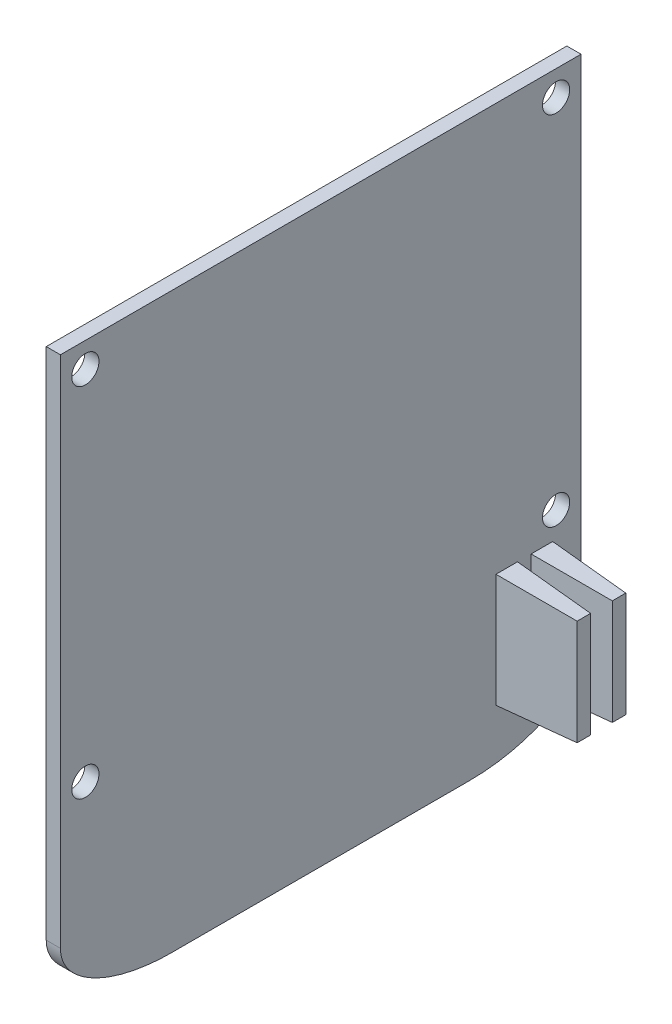
from build123d import *

# Parameters (mm, degrees)
BOSS_EXTRUDE1_DEPTH           = 1.5875
SKETCH2_R                     = 1.524
CUT_EXTRUDE1_DEPTH            = 2.54
SKETCH6_W                     = 2.413
SKETCH6_H                     = 12.7
BOSS_EXTRUDE2_DEPTH           = 8.636
BOSS_EXTRUDE2_DRAFT           = 3
BOSS_EXTRUDE2_PROFILE_2_DEPTH = 8.636
BOSS_EXTRUDE2_PROFILE_2_DRAFT = 3


with BuildPart() as part:
    # Sketch1 → Boss-Extrude1 (new body)
    with BuildSketch(Plane(origin=(0, 0, 0), x_dir=(0, 0, -1), z_dir=(1, 0, 0))):
        with BuildLine():
            Line((45.182706914, 6.18069038), (-13.097593086, 6.18069038))
            Line((-13.097593086, 6.18069038), (-13.097593086, -51.36046962))
            add(Edge.make_bspline(
                [(-13.097593086, -51.36046962), (-13.097593086, -58.00510962), (-0.650340424, -58.00510962)],
                knots=[3.141592654, 3.141592654, 3.141592654, 4.71238898, 4.71238898, 4.71238898], degree=2, weights=[1, 0.707106781, 1]))
            Line((-0.650340424, -58.00510962), (32.623659576, -58.00510962))
            add(Edge.make_bspline(
                [(32.623659576, -58.00510962), (45.182706914, -58.00510962), (45.182706914, -51.36046962)],
                knots=[4.71238898, 4.71238898, 4.71238898, 6.283185307, 6.283185307, 6.283185307], degree=2, weights=[1, 0.707106781, 1]))
            Line((45.182706914, -51.36046962), (45.182706914, -39.42246962))
            Line((45.182706914, -39.42246962), (45.182706914, 6.18069038))
        make_face()
    extrude(amount=BOSS_EXTRUDE1_DEPTH)

    # Sketch2 → Cut-Extrude1 (cut)
    with BuildSketch(Plane.ZY):
        with Locations((-42.388706914, 3.38669038)):
            Circle(SKETCH2_R)
        with Locations((10.303593086, 3.38669038)):
            Circle(SKETCH2_R)
        with Locations((-42.388706914, -36.60560962)):
            Circle(SKETCH2_R)
        with Locations((10.303593086, -36.60560962)):
            Circle(SKETCH2_R)
    extrude(amount=-CUT_EXTRUDE1_DEPTH, mode=Mode.SUBTRACT)


with BuildPart() as boss_extrude2_tool:
    # Sketch6 → Boss-Extrude2 (with draft: the straight prism first)
    with BuildSketch(Plane(origin=(1.5875, 0, 0), x_dir=(0, 0, -1), z_dir=(1, 0, 0))):
        with Locations((40.801206914, -45.82580962)):
            Rectangle(SKETCH6_W, SKETCH6_H)
    extrude(amount=BOSS_EXTRUDE2_DEPTH)
    # Boss-Extrude2: the draft: its side faces are tilted about the plane it starts from
    boss_extrude2_sides = [boss_extrude2_tool.faces().sort_by_distance(p)[0] for p in [
        (5.9055, -39.47580962, -40.801206914),
        (5.9055, -45.82580962, -39.594706914),
        (5.9055, -52.17580962, -40.801206914),
        (5.9055, -45.82580962, -42.007706914),
    ]]
    draft(boss_extrude2_sides, Plane(origin=(1.5875, 0, 0), x_dir=(0, 0, -1), z_dir=(1, 0, 0)), BOSS_EXTRUDE2_DRAFT)


with BuildPart() as part_1:
    add(part.part)

    # Boss-Extrude2: add boss_extrude2_tool
    add(boss_extrude2_tool.part)


with BuildPart() as boss_extrude2_profile_2_tool:
    # Sketch6 → Boss-Extrude2 profile 2 (with draft: the straight prism first)
    with BuildSketch(Plane(origin=(1.5875, 0, 0), x_dir=(0, 0, -1), z_dir=(1, 0, 0))):
        with Locations((36.864206914, -45.82580962)):
            Rectangle(SKETCH6_W, SKETCH6_H)
    extrude(amount=BOSS_EXTRUDE2_PROFILE_2_DEPTH)
    # Boss-Extrude2 profile 2: the draft: its side faces are tilted about the plane it starts from
    boss_extrude2_profile_2_sides = [boss_extrude2_profile_2_tool.faces().sort_by_distance(p)[0] for p in [
        (5.9055, -52.17580962, -36.864206914),
        (5.9055, -45.82580962, -38.070706914),
        (5.9055, -39.47580962, -36.864206914),
        (5.9055, -45.82580962, -35.657706914),
    ]]
    draft(boss_extrude2_profile_2_sides, Plane(origin=(1.5875, 0, 0), x_dir=(0, 0, -1), z_dir=(1, 0, 0)), BOSS_EXTRUDE2_PROFILE_2_DRAFT)


with BuildPart() as part_2:
    add(part_1.part)

    # Boss-Extrude2 profile 2: add boss_extrude2_profile_2_tool
    add(boss_extrude2_profile_2_tool.part)


solid = part_2.part
